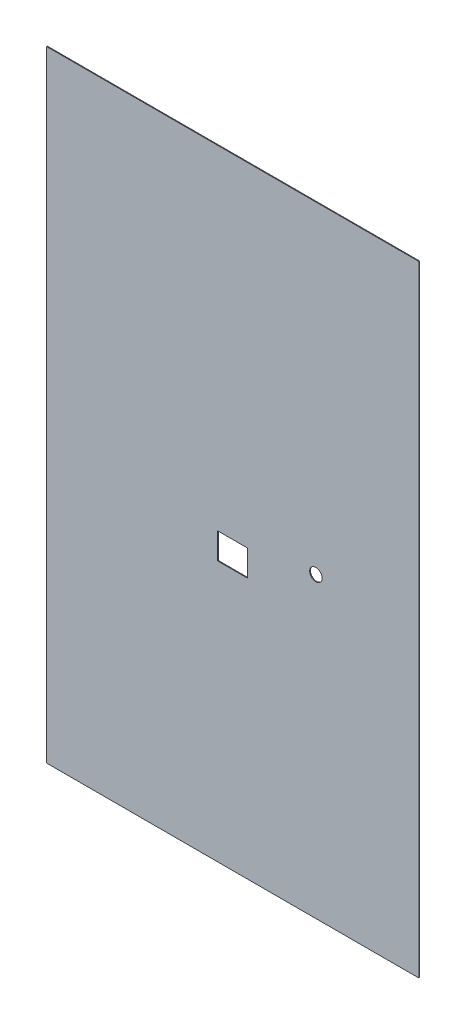
from build123d import *

# Parameters (mm, degrees)
SKETCH_1_W          = 1500
SKETCH_1_H          = 2500
EXTRUDE_1_DEPTH     = 3
SKETCH_3_W          = 120
SKETCH_3_H          = 105
CUT_EXTRUDE_2_DEPTH = 2916.47749091
SKETCH_4_R          = 25
CUT_EXTRUDE_3_DEPTH = 300


with BuildPart() as part:
    # 草圖1 → 填料-伸長1 (new body)
    with BuildSketch(Plane.XY):
        with Locations((750, -1250)):
            Rectangle(SKETCH_1_W, SKETCH_1_H)
    extrude(amount=EXTRUDE_1_DEPTH)

    # 草圖3 → 除料-伸長2 (cut, through all)
    with BuildSketch(Plane.XY.offset(3)):
        with Locations((750, -1397.5)):
            Rectangle(SKETCH_3_W, SKETCH_3_H)
    extrude(amount=-CUT_EXTRUDE_2_DEPTH, mode=Mode.SUBTRACT)

    # 草圖4 → 除料-伸長3 (cut)
    with BuildSketch(Plane.XY.offset(3)):
        with Locations((1085.367901205, -1300)):
            Circle(SKETCH_4_R)
    extrude(amount=-CUT_EXTRUDE_3_DEPTH, mode=Mode.SUBTRACT)


solid = part.part
